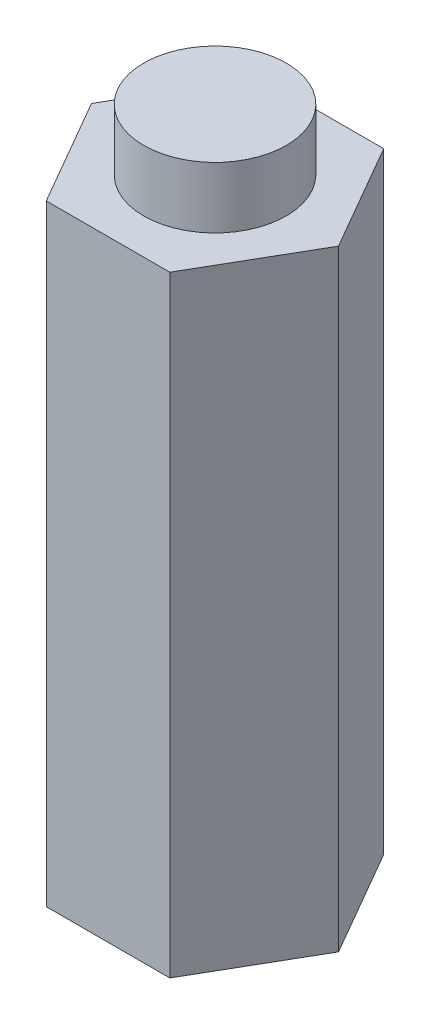
from build123d import *

# Parameters (mm, degrees)
BOSS_EXTRUDE2_DEPTH = 60
SKETCH3_R           = 7
BOSS_EXTRUDE3_DEPTH = 6


with BuildPart() as part:
    # Sketch2 → Boss-Extrude2 (new body)
    with BuildSketch(Plane(origin=(0, 0, 0), x_dir=(1, 0, 0), z_dir=(0, 1, 0))):
        Polygon((-12.124355653, 0), (-6.062177826, -10.5), (6.062177826, -10.5), (12.124355653, 0), (6.062177826, 10.5), (-6.062177826, 10.5), align=None)
    extrude(amount=BOSS_EXTRUDE2_DEPTH)

    # Sketch3 → Boss-Extrude3 (add)
    with BuildSketch(Plane(origin=(0, 60, 0), x_dir=(1, 0, 0), z_dir=(0, 1, 0))):
        with Locations(Location((0, 0, 0), (0, 0, 270))):
            Circle(SKETCH3_R)
    extrude(amount=BOSS_EXTRUDE3_DEPTH)


solid = part.part
